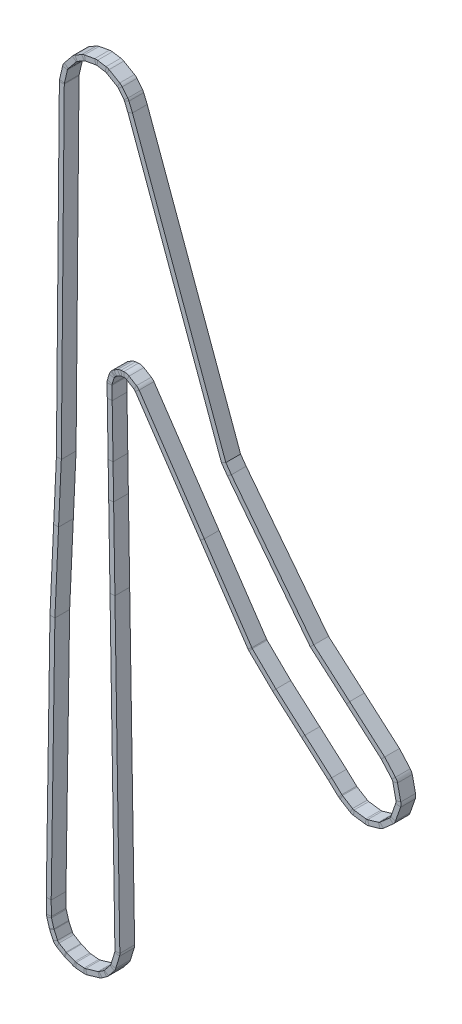
from build123d import *

# Parameters (mm, degrees)
SKETCH2_W = 3.175
SKETCH2_H = 9.525


with BuildPart() as part:
    # Sweep2: sweep along a path in Sketch3
    with BuildLine(Plane.XY) as sweep2_path:
        Line((-113.2737118, 38.708117082), (-111.360721436, 249.379390693))
        ThreePointArc((-111.360721436, 249.379390693), (-111.332420837, 249.821186134), (-111.255887181, 250.257221378))
        Line((-111.255887181, 250.257221378), (-109.284458997, 258.728766138))
        ThreePointArc((-109.284458997, 258.728766138), (-108.977718764, 259.589939578), (-108.484981839, 260.359952296))
        Line((-108.484981839, 260.359952296), (-103.282636061, 266.75674516))
        ThreePointArc((-103.282636061, 266.75674516), (-102.756391934, 267.292948788), (-102.139857158, 267.72228791))
        Line((-102.139857158, 267.72228791), (-97.705310427, 270.232257173))
        ThreePointArc((-97.705310427, 270.232257173), (-97.099213189, 270.511865479), (-96.455310702, 270.687718411))
        Line((-96.455310702, 270.687718411), (-89.81400683, 271.922248795))
        ThreePointArc((-89.81400683, 271.922248795), (-89.130886981, 271.989834012), (-88.446197303, 271.940635079))
        Line((-88.446197303, 271.940635079), (-83.021566423, 271.08242135))
        ThreePointArc((-83.021566423, 271.08242135), (-82.294959452, 270.896906612), (-81.615236441, 270.580125874))
        Line((-81.615236441, 270.580125874), (-74.7314453, 266.554324945))
        ThreePointArc((-74.7314453, 266.554324945), (-74.118213296, 266.113850415), (-73.597787439, 265.566832836))
        Line((-73.597787439, 265.566832836), (-70.049367073, 261.058239928))
        ThreePointArc((-70.049367073, 261.058239928), (-69.738852705, 260.602822601), (-69.493309345, 260.109332405))
        Line((-69.493309345, 260.109332405), (-67.261275087, 254.73040224))
        Line((-67.261275087, 254.73040224), (-6.941755467, 89.285005285))
        Line((-6.941755467, 89.285005285), (-3.231032024, 84.040402532))
        Line((-3.231032024, 84.040402532), (50.101698719, 15.408654079))
        Line((50.101698719, 15.408654079), (73.399803391, -4.844079329))
        Line((73.399803391, -4.844079329), (95.879395188, -24.385290349))
        Line((95.879395188, -24.385290349), (102.824689799, -32.216189667))
        ThreePointArc((102.824689799, -32.216189667), (103.404928271, -33.069191103), (103.749876732, -34.041455827))
        Line((103.749876732, -34.041455827), (105.827646301, -43.660645814))
        ThreePointArc((105.827646301, -43.660645814), (105.910874738, -44.76199459), (105.692323663, -45.844644824))
        Line((105.692323663, -45.844644824), (102.427981706, -55.176631366))
        ThreePointArc((102.427981706, -55.176631366), (101.970192205, -56.092116344), (101.29675576, -56.862938844))
        Line((101.29675576, -56.862938844), (95.055492396, -62.398371118))
        ThreePointArc((95.055492396, -62.398371118), (94.331538752, -62.910234776), (93.513261785, -63.251608602))
        Line((93.513261785, -63.251608602), (86.45390944, -65.320847467))
        ThreePointArc((86.45390944, -65.320847467), (85.619549108, -65.4725405), (84.771911966, -65.446478779))
        Line((84.771911966, -65.446478779), (77.099072545, -64.396283398))
        ThreePointArc((77.099072545, -64.396283398), (76.283378023, -64.196415993), (75.526732453, -63.832009605))
        Line((75.526732453, -63.832009605), (68.979699675, -59.790081143))
        ThreePointArc((68.979699675, -59.790081143), (68.654739084, -59.566821581), (68.353121076, -59.312910581))
        Line((68.353121076, -59.312910581), (61.750751055, -53.179268646))
        Line((61.750751055, -53.179268646), (44.550979261, -38.030855195))
        Line((44.550979261, -38.030855195), (25.785057846, -21.503081467))
        Line((25.785057846, -21.503081467), (10.533062911, -6.592895999))
        ThreePointArc((10.533062911, -6.592895999), (10.256081461, -6.293266816), (10.010780753, -5.967193306))
        Line((10.010780753, -5.967193306), (-20.700338223, 39.469578483))
        Line((-20.700338223, 39.469578483), (-62.716087861, 101.63143033))
        ThreePointArc((-62.716087861, 101.63143033), (-63.26534828, 102.283262218), (-63.9392927, 102.805153718))
        Line((-63.9392927, 102.805153718), (-68.728924628, 105.76211915))
        ThreePointArc((-68.728924628, 105.76211915), (-69.910174459, 106.253059347), (-71.185739502, 106.349533497))
        Line((-71.185739502, 106.349533497), (-73.001476649, 106.197177697))
        ThreePointArc((-73.001476649, 106.197177697), (-73.85404056, 106.03184548), (-74.651472845, 105.687895318))
        Line((-74.651472845, 105.687895318), (-76.862561095, 104.436411483))
        ThreePointArc((-76.862561095, 104.436411483), (-77.42820188, 104.049362693), (-77.920167775, 103.572156424))
        Line((-77.920167775, 103.572156424), (-78.42760636, 102.988415108))
        ThreePointArc((-78.42760636, 102.988415108), (-78.911460574, 102.297375533), (-79.241040714, 101.520827063))
        Line((-79.241040714, 101.520827063), (-80.431908347, 97.624759631))
        ThreePointArc((-80.431908347, 97.624759631), (-80.568589291, 97.008836096), (-80.607579607, 96.379135185))
        Line((-80.607579607, 96.379135185), (-80.467338955, 87.842693006))
        Line((-80.467338955, 87.842693006), (-79.911334943, 53.99875375))
        Line((-79.911334943, 53.99875375), (-79.544884256, 31.692916913))
        Line((-79.544884256, 31.692916913), (-78.690787986, -20.295884749))
        Line((-78.690787986, -20.295884749), (-75.519963788, -218.599853279))
        ThreePointArc((-75.519963788, -218.599853279), (-75.559106451, -219.228660879), (-75.695663729, -219.84370824))
        Line((-75.695663729, -219.84370824), (-78.151558106, -227.878463597))
        ThreePointArc((-78.151558106, -227.878463597), (-78.449535245, -228.596874981), (-78.879820237, -229.244763951))
        Line((-78.879820237, -229.244763951), (-82.591233917, -233.808310004))
        ThreePointArc((-82.591233917, -233.808310004), (-82.96564838, -234.209535721), (-83.39104769, -234.556239765))
        Line((-83.39104769, -234.556239765), (-86.338313839, -236.641524411))
        ThreePointArc((-86.338313839, -236.641524411), (-86.912085482, -236.980104951), (-87.533752474, -237.219647913))
        Line((-87.533752474, -237.219647913), (-95.539541437, -239.566306482))
        ThreePointArc((-95.539541437, -239.566306482), (-96.270665268, -239.708953959), (-97.015552278, -239.714759065))
        Line((-97.015552278, -239.714759065), (-102.192634198, -239.27545068))
        ThreePointArc((-102.192634198, -239.27545068), (-102.791583818, -239.178847579), (-103.36927658, -238.993526563))
        Line((-103.36927658, -238.993526563), (-108.786905191, -236.79388863))
        ThreePointArc((-108.786905191, -236.79388863), (-109.067900951, -236.6670887), (-109.338394843, -236.519203968))
        Line((-109.338394843, -236.519203968), (-113.907305759, -233.789546433))
        ThreePointArc((-113.907305759, -233.789546433), (-114.839005112, -233.022705767), (-115.502260966, -232.014638328))
        Line((-115.502260966, -232.014638328), (-117.734613035, -227.170601344))
        ThreePointArc((-117.734613035, -227.170601344), (-117.848513199, -226.897525099), (-117.942094476, -226.616835898))
        Line((-117.942094476, -226.616835898), (-119.53057144, -221.197636228))
        ThreePointArc((-119.53057144, -221.197636228), (-119.64924206, -220.658532361), (-119.693215105, -220.108275997))
        Line((-119.693215105, -220.108275997), (-119.797821097, -210.83616373))
        Line((-119.797821097, -210.83616373), (-117.411103459, -51.966375222))
        Line((-117.411103459, -51.966375222), (-113.2737118, 38.708117082))
    # Sketch2 → Sweep2 (sweep)
    with BuildSketch(Plane(origin=(0, 0, 0), x_dir=(1, 0, 0), z_dir=(0, 1, 0))):
        with Locations((-115.053509025, -0.006992659)):
            Rectangle(SKETCH2_W, SKETCH2_H)
    sweep(path=sweep2_path.line, transition=Transition.RIGHT)


solid = part.part
